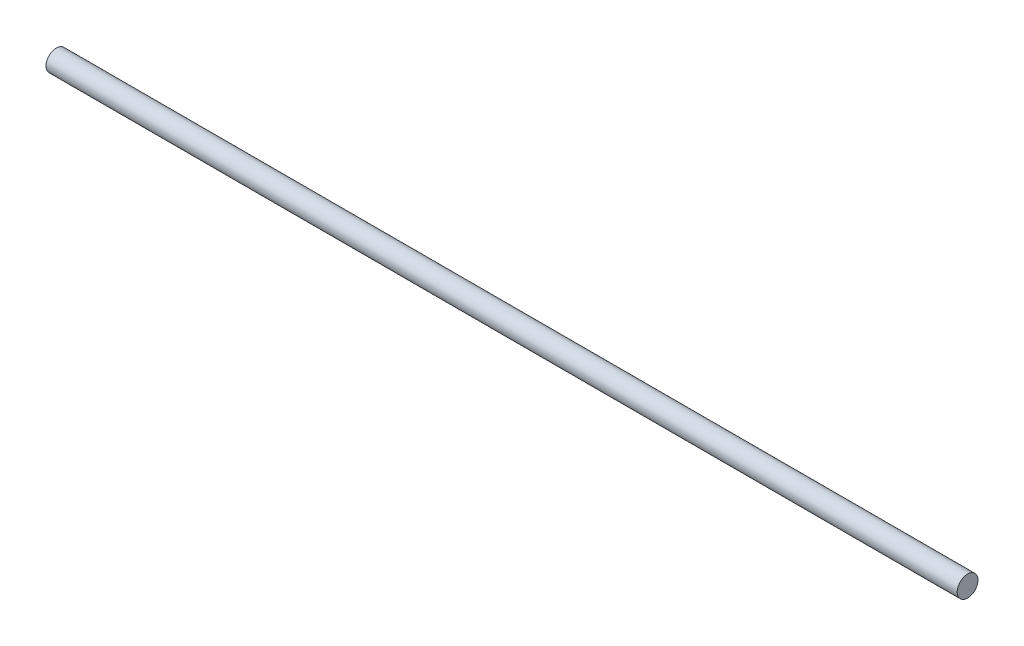
from build123d import *

# Parameters (mm, degrees)
SKETCH_1_R      = 4
EXTRUDE_1_DEPTH = 350


with BuildPart() as part:
    # 草图1 → 凸台-拉伸1 (new body)
    with BuildSketch(Plane(origin=(0, 0, 0), x_dir=(0, 0, -1), z_dir=(1, 0, 0))):
        Circle(SKETCH_1_R)
    extrude(amount=EXTRUDE_1_DEPTH)


solid = part.part
